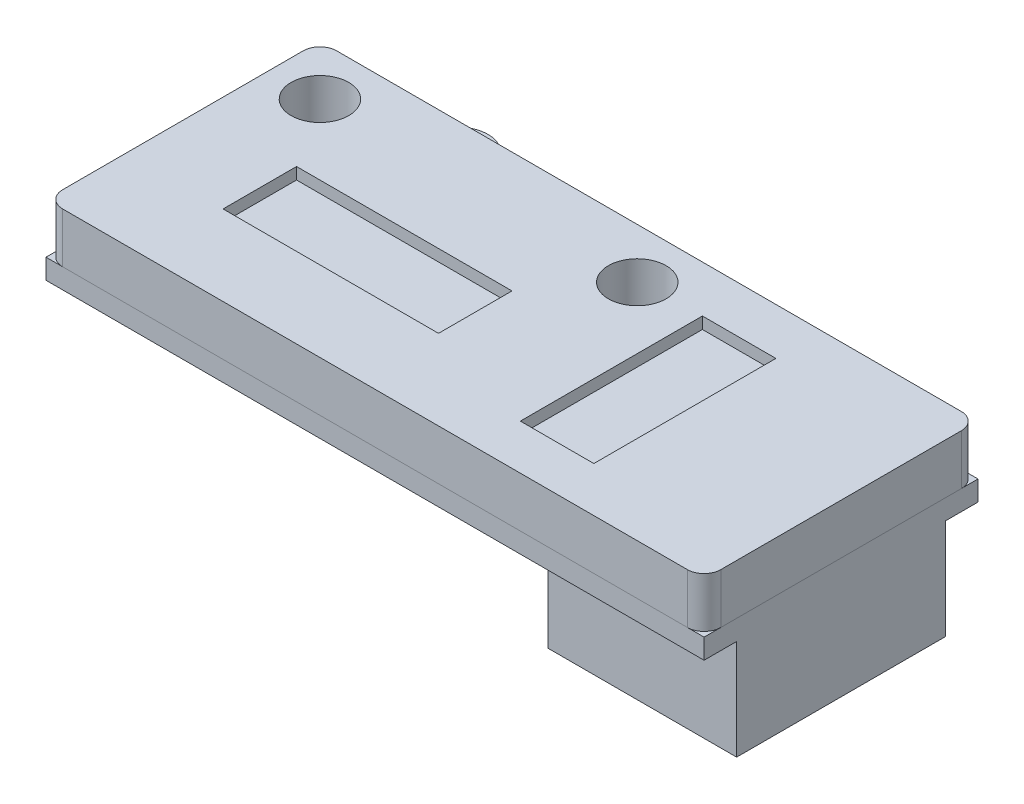
from build123d import *

# Parameters (mm, degrees)
SKETCH1_W           = 39.4
SKETCH1_H           = 16.4
SKETCH1_R           = 1.725
BOSS_EXTRUDE1_DEPTH = 1.2
SKETCH2_W           = 12.5
SKETCH2_H           = 4
SKETCH2_W_2         = 4
SKETCH2_H_2         = 10.5
BOSS_EXTRUDE2_DEPTH = 2.5
SKETCH3_W           = 11.3
SKETCH3_H           = 12.5
SKETCH3_W_2         = 12.75
SKETCH3_H_2         = 6.6
BOSS_EXTRUDE3_DEPTH = 6
BOSS_EXTRUDE4_DEPTH = 2
SKETCH5_W           = 39.4
SKETCH5_H           = 16.4
SKETCH5_R           = 1.725
SKETCH5_W_2         = 12.9
SKETCH5_H_2         = 4.4
SKETCH5_W_3         = 4.4
SKETCH5_H_3         = 10.9
BOSS_EXTRUDE5_DEPTH = 3
FILLET1_R           = 1


with BuildPart() as part:
    # Sketch1 → Boss-Extrude1 (new body)
    with BuildSketch(Plane(origin=(0, 0, 0), x_dir=(1, 0, 0), z_dir=(0, 1, 0))):
        Rectangle(SKETCH1_W, SKETCH1_H)
        with Locations(Location((-16.7, 5.2, 0), (0, 0, 270))):
            Circle(SKETCH1_R, mode=Mode.SUBTRACT)
        with Locations(Location((2.3, 5.2, 0), (0, 0, 270))):
            Circle(SKETCH1_R, mode=Mode.SUBTRACT)
    extrude(amount=BOSS_EXTRUDE1_DEPTH)

    # Sketch2 → Boss-Extrude2 (add)
    with BuildSketch(Plane(origin=(0, 1.2, 0), x_dir=(1, 0, 0), z_dir=(0, 1, 0))):
        with Locations((-7.45, -1.2)):
            Rectangle(SKETCH2_W, SKETCH2_H)
        with Locations((8.2, -0.05)):
            Rectangle(SKETCH2_W_2, SKETCH2_H_2)
    extrude(amount=BOSS_EXTRUDE2_DEPTH)

    # Sketch3 → Boss-Extrude3 (add)
    with BuildSketch(Plane.XZ):
        with Locations((14.05, 0)):
            Rectangle(SKETCH3_W, SKETCH3_H)
        with Locations((-7.2, -4.9)):
            Rectangle(SKETCH3_W_2, SKETCH3_H_2)
    extrude(amount=BOSS_EXTRUDE3_DEPTH)

    # Sketch4 → Boss-Extrude4 (add, symmetric)
    with BuildSketch(Plane(origin=(0, -3, 0), x_dir=(-1, 0, 0), z_dir=(0, -1, 0))):
        with BuildLine():
            Line((1.825, 8.2), (13.224013115, 11.95))
            ThreePointArc((13.224013115, 11.95), (14.96605462, 13.598761551), (16.825, 12.083028945))
            Line((16.825, 12.083028945), (16.627742085, 12.050024171))
            ThreePointArc((16.627742085, 12.050024171), (14.909005352, 13.395228648), (13.416459603, 11.802765704))
            Line((13.416459603, 11.802765704), (2.465, 8.2))
            Line((2.465, 8.2), (1.825, 8.2))
        make_face()
    extrude(amount=BOSS_EXTRUDE4_DEPTH, both=True)


with BuildPart() as body_2:
    # Sketch5 → Boss-Extrude5 (new body)
    with BuildSketch(Plane(origin=(0, 1.2, 0), x_dir=(1, 0, 0), z_dir=(0, 1, 0))):
        Rectangle(SKETCH5_W, SKETCH5_H)
        with Locations(Location((2.3, 5.2, 0), (0, 0, 270))):
            Circle(SKETCH5_R, mode=Mode.SUBTRACT)
        with Locations(Location((-16.7, 5.2, 0), (0, 0, 270))):
            Circle(SKETCH5_R, mode=Mode.SUBTRACT)
        with Locations((-7.45, -1.2)):
            Rectangle(SKETCH5_W_2, SKETCH5_H_2, mode=Mode.SUBTRACT)
        with Locations((8.2, -0.05)):
            Rectangle(SKETCH5_W_3, SKETCH5_H_3, mode=Mode.SUBTRACT)
    extrude(amount=BOSS_EXTRUDE5_DEPTH)

    # Fillet1
    fillet1_edges = [body_2.edges().sort_by_distance(p)[0] for p in [
        (19.7, 2.7, -8.2),
        (19.7, 2.7, 8.2),
        (-19.7, 2.7, 8.2),
        (-19.7, 2.7, -8.2),
    ]]
    fillet(fillet1_edges, radius=FILLET1_R)


solid = Compound([part.part, body_2.part])
